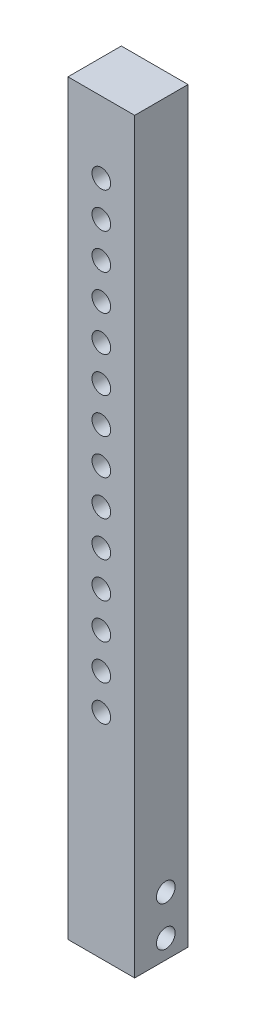
from build123d import *

# Parameters (mm, degrees)
SKETCH_1_W          = 15
SKETCH_1_H          = 170
EXTRUDE_1_DEPTH     = 12
SKETCH_2_W          = 8.1
SKETCH_2_H          = 10.1
CUT_EXTRUDE_1_DEPTH = 20.5
CUT_EXTRUDE_2_REACH = 89.144
SKETCH_3_R          = 2.1
SKETCH_5_R          = 2.1
CUT_EXTRUDE_3_DEPTH = 12
SKETCH_6_W          = 15
SKETCH_6_H          = 12
CUT_EXTRUDE_4_DEPTH = 2


with BuildPart() as part:
    # 草图1 → 凸台-拉伸1 (new body)
    with BuildSketch(Plane.XY):
        Rectangle(SKETCH_1_W, SKETCH_1_H)
    extrude(amount=EXTRUDE_1_DEPTH)

    # 草图2 → 切除-拉伸1 (cut)
    with BuildSketch(Plane.XZ.offset(85)):
        with Locations((-1.5, 5.05)):
            Rectangle(SKETCH_2_W, SKETCH_2_H)
    extrude(amount=-CUT_EXTRUDE_1_DEPTH, mode=Mode.SUBTRACT)

    # 切除-拉伸2: up to this face of the body (flat: up to its plane)
    cut_extrude_2_end = Plane(part.part.faces().sort_by_distance((-7.5, 0, 6))[0])
    # 草图3 → 切除-拉伸2 (cut, up to the picked face)
    with BuildSketch(Plane(origin=(7.5, 0, 0), x_dir=(0, 0, -1), z_dir=(1, 0, 0)), mode=Mode.PRIVATE) as cut_extrude_2_sk1:
        with Locations((-5, -69.75)):
            Circle(SKETCH_3_R)
    cut_extrude_2_tool1 = split(extrude(cut_extrude_2_sk1.sketch, amount=-CUT_EXTRUDE_2_REACH, mode=Mode.PRIVATE), bisect_by=cut_extrude_2_end, keep=Keep.BOTH, mode=Mode.PRIVATE)
    # 草图3 → 切除-拉伸2 (cut, up to the picked face)
    with BuildSketch(Plane(origin=(7.5, 0, 0), x_dir=(0, 0, -1), z_dir=(1, 0, 0)), mode=Mode.PRIVATE) as cut_extrude_2_sk2:
        with Locations((-5, -78.75)):
            Circle(SKETCH_3_R)
    cut_extrude_2_tool2 = split(extrude(cut_extrude_2_sk2.sketch, amount=-CUT_EXTRUDE_2_REACH, mode=Mode.PRIVATE), bisect_by=cut_extrude_2_end, keep=Keep.BOTH, mode=Mode.PRIVATE)
    add(cut_extrude_2_tool1.solids().sort_by(Axis((7.5, -69.75, 5), (-1, 0, 0)))[0], mode=Mode.SUBTRACT)
    add(cut_extrude_2_tool2.solids().sort_by(Axis((7.5, -78.75, 5), (-1, 0, 0)))[0], mode=Mode.SUBTRACT)

    # 草图5 → 切除-拉伸3 (cut)
    with BuildSketch(Plane.XY.offset(12)):
        with Locations((0, -27)):
            Circle(SKETCH_5_R)
        with Locations((0, -35)):
            Circle(SKETCH_5_R)
        with Locations((0, -19)):
            Circle(SKETCH_5_R)
        with Locations((0, -11)):
            Circle(SKETCH_5_R)
        with Locations((0, -3)):
            Circle(SKETCH_5_R)
        with Locations((0, 5)):
            Circle(SKETCH_5_R)
        with Locations((0, 13)):
            Circle(SKETCH_5_R)
        with Locations((0, 21)):
            Circle(SKETCH_5_R)
        with Locations((0, 29)):
            Circle(SKETCH_5_R)
        with Locations((0, 37)):
            Circle(SKETCH_5_R)
        with Locations((0, 45)):
            Circle(SKETCH_5_R)
        with Locations((0, 53)):
            Circle(SKETCH_5_R)
        with Locations((0, 61)):
            Circle(SKETCH_5_R)
        with Locations((0, 69)):
            Circle(SKETCH_5_R)
    extrude(amount=-CUT_EXTRUDE_3_DEPTH, mode=Mode.SUBTRACT)

    # 草图6 → 切除-拉伸4 (cut)
    with BuildSketch(Plane.XZ.offset(85)):
        with Locations((0, 6)):
            Rectangle(SKETCH_6_W, SKETCH_6_H)
    extrude(amount=-CUT_EXTRUDE_4_DEPTH, mode=Mode.SUBTRACT)


solid = part.part
